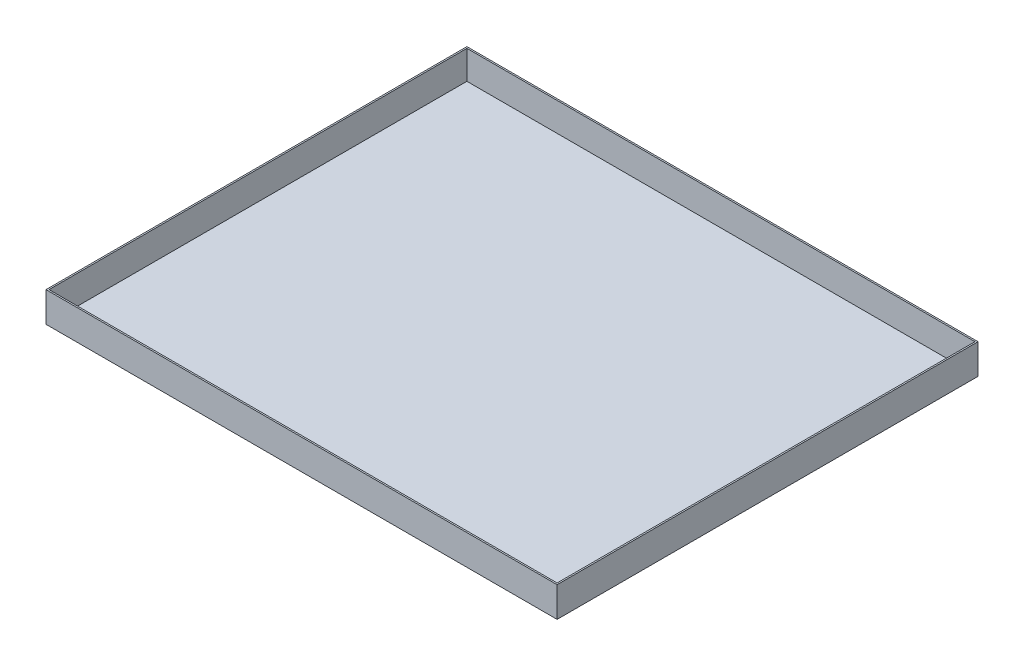
from build123d import *

# Parameters (mm, degrees)
SKETCH1_W           = 170
SKETCH1_H           = 140
BOSS_EXTRUDE1_DEPTH = 10
SHELL1_T            = -0.5


with BuildPart() as part:
    # Sketch1 → Boss-Extrude1 (new body)
    with BuildSketch(Plane(origin=(0, 0, 0), x_dir=(1, 0, 0), z_dir=(0, 1, 0))):
        Rectangle(SKETCH1_W, SKETCH1_H)
    extrude(amount=BOSS_EXTRUDE1_DEPTH)

    # Shell1
    shell1_openings = [part.faces().sort_by_distance(p)[0] for p in [
        (0, 10, 0),
    ]]
    offset(amount=SHELL1_T, openings=shell1_openings, kind=Kind.INTERSECTION)


solid = part.part
